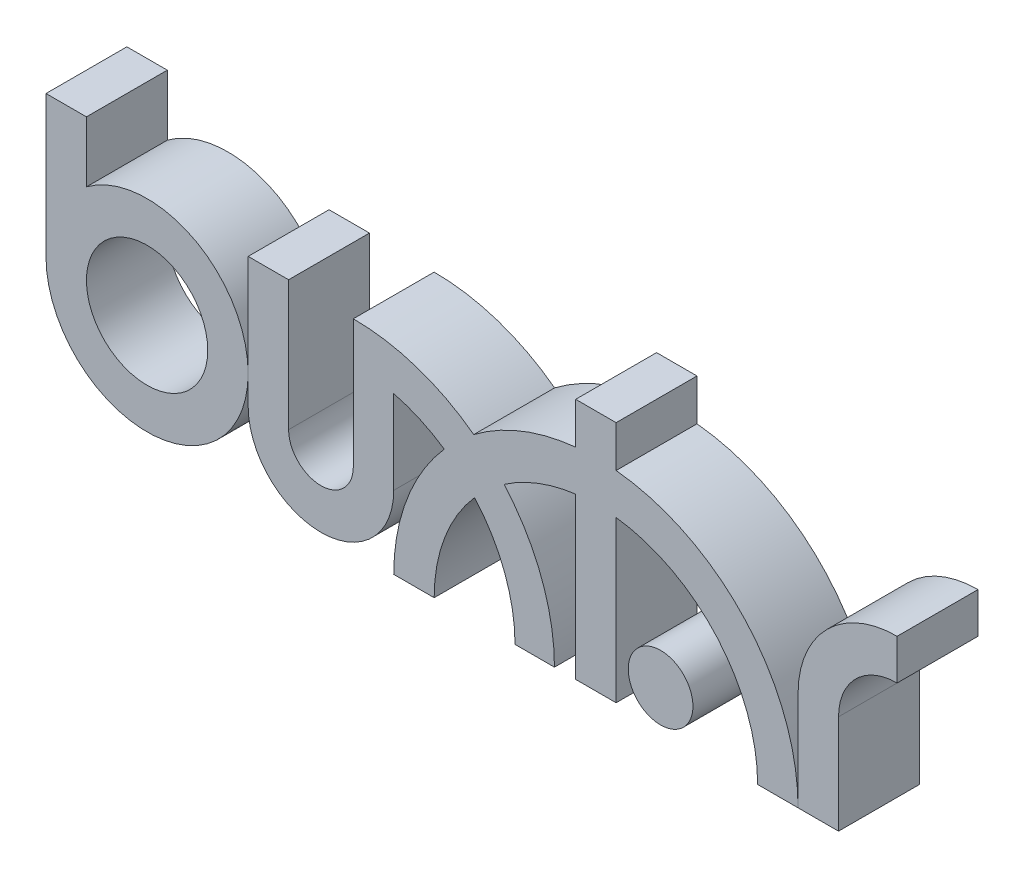
from build123d import *

# Parameters (mm, degrees)
SKETCH_1_R        = 7.5
EXTRUDE_1_DEPTH   = 10
EXTRUDE_1_2_DEPTH = 10
EXTRUDE_1_3_DEPTH = 10
SKETCH_1_R_2      = 4
EXTRUDE_1_4_DEPTH = 10


with BuildPart() as part:
    # Эскиз1 → Бобышка-Вытянуть1 (new body)
    with BuildSketch(Plane.XY):
        with BuildLine():
            ThreePointArc((-68, 12.5), (-44.319660113, 6.909830056), (-63, 22.5))
            Line((-63, 22.5), (-63, 30))
            Line((-63, 30), (-68, 30))
            Line((-68, 30), (-68, 12.5))
        make_face()
        with Locations((-55.5, 12.5)):
            Circle(SKETCH_1_R, mode=Mode.SUBTRACT)
    extrude(amount=EXTRUDE_1_DEPTH)


with BuildPart() as body_2:
    # Эскиз1 → Extrude 1 2 (new body)
    with BuildSketch(Plane.XY):
        with BuildLine():
            Line((2.5, 24.874685928), (2.5, 30))
            Line((2.5, 30), (-2.5, 30))
            Line((-2.5, 30), (-2.5, 24.874685928))
            ThreePointArc((-2.5, 24.874685928), (-9.14386728, 23.267782257), (-15.104166667, 19.921449478))
            ThreePointArc((-15.104166667, 19.921449478), (-22.151108326, 23.603917037), (-30, 24.874685928))
            Line((-30, 24.874685928), (-30, 8.998997376))
            ThreePointArc((-30, 8.998997376), (-34, 4.998997376), (-38, 8.998997376))
            Line((-38, 8.998997376), (-38, 25.054939633))
            Line((-38, 25.054939633), (-43, 25.054939633))
            Line((-43, 25.054939633), (-43, 12.5))
            Line((-43, 12.5), (-43, 8.998997376))
            ThreePointArc((-43, 8.998997376), (-34, -0.001002624), (-25, 8.998997376))
            Line((-25, 8.998997376), (-25, 19.364916731))
            ThreePointArc((-25, 19.364916731), (-21.752794759, 18.220417276), (-18.75, 16.535945694))
            ThreePointArc((-18.75, 16.535945694), (-23.385358667, 8.838834765), (-25, 0))
            Line((-25, 0), (-20, 0))
            ThreePointArc((-20, 0), (-18.708286934, 7.071067812), (-15, 13.228756555))
            ThreePointArc((-15, 13.228756555), (-11.291713066, 7.071067812), (-10, 0))
            Line((-10, 0), (-5.125314072, 0))
            ThreePointArc((-5.125314072, 0), (-6.73458309, 8.801725739), (-11.354166667, 16.464595328))
            ThreePointArc((-11.354166667, 16.464595328), (-7.130085259, 18.685873921), (-2.5, 19.843134833))
            Line((-2.5, 19.843134833), (-2.5, 0))
            Line((-2.5, 0), (2.5, 0))
            Line((2.5, 0), (2.5, 19.843134833))
            ThreePointArc((2.5, 19.843134833), (15, 13.228756555), (20, 0))
            Line((20, 0), (25, 0))
            ThreePointArc((25, 0), (18.540496218, 16.770509831), (2.5, 24.874685928))
        make_face()
    extrude(amount=EXTRUDE_1_2_DEPTH)


with BuildPart() as body_3:
    # Эскиз1 → Extrude 1 3 (new body)
    with BuildSketch(Plane.XY):
        with BuildLine():
            Line((25, 12.25), (25, 0))
            Line((25, 0), (30.004893159, 0))
            Line((30.004893159, 0), (30.004893159, 12.25))
            ThreePointArc((30.004893159, 12.25), (32.126935822, 17.373064178), (37.25, 19.495106841))
            Line((37.25, 19.495106841), (37.25, 24.5))
            ThreePointArc((37.25, 24.5), (28.58794193, 20.91205807), (25, 12.25))
        make_face()
    extrude(amount=EXTRUDE_1_3_DEPTH)


with BuildPart() as body_4:
    # Эскиз1 → Extrude 1 4 (new body)
    with BuildSketch(Plane.XY):
        with Locations((8, 4.369690994)):
            Circle(SKETCH_1_R_2)
    extrude(amount=EXTRUDE_1_4_DEPTH)


solid = Compound([part.part, body_2.part, body_3.part, body_4.part])
